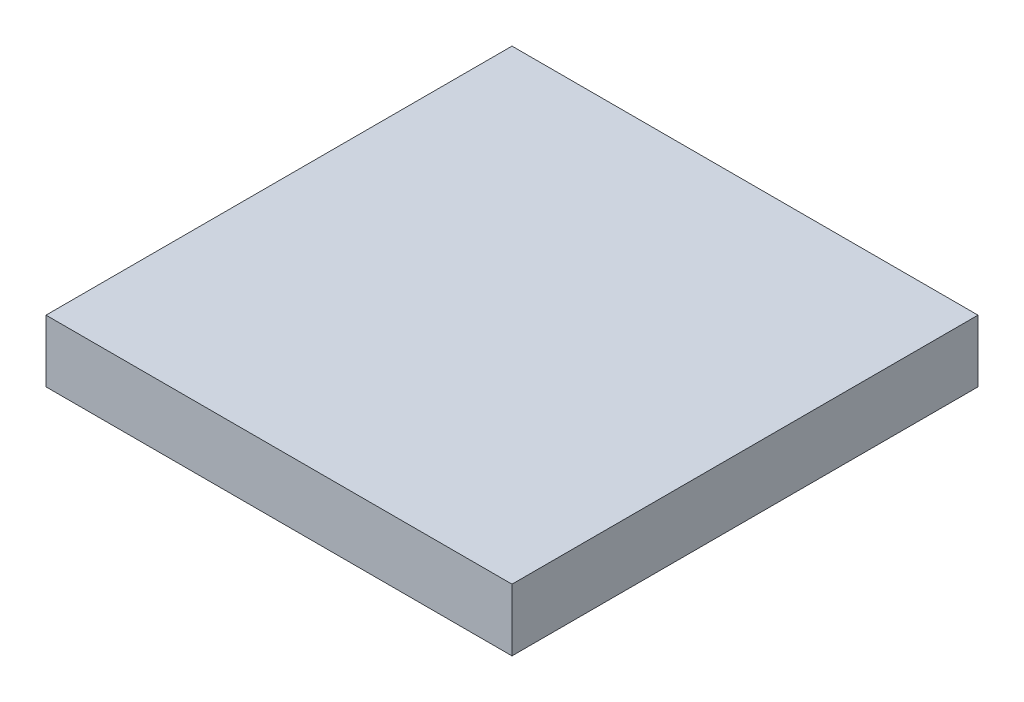
from build123d import *

# Parameters (mm, degrees)
SKETCH1_W           = 30
SKETCH1_H           = 30
BOSS_EXTRUDE1_DEPTH = 2
SKETCH2_R           = 4.25
CUT_EXTRUDE1_DEPTH  = 22.587033145


with BuildPart() as part:
    # Sketch1 → Boss-Extrude1 (new, symmetric)
    with BuildSketch(Plane(origin=(0, 0, 0), x_dir=(1, 0, 0), z_dir=(0, 1, 0))):
        Rectangle(SKETCH1_W, SKETCH1_H)
    extrude(amount=BOSS_EXTRUDE1_DEPTH, both=True)

    # Sketch2 → Cut-Extrude1 (cut, through all)
    with BuildSketch(Plane(origin=(0, 2, 0), x_dir=(1, 0, 0), z_dir=(0, 1, 0))):
        with Locations((30.9, 24)):
            Circle(SKETCH2_R)
    extrude(amount=-CUT_EXTRUDE1_DEPTH, mode=Mode.SUBTRACT)


solid = part.part
